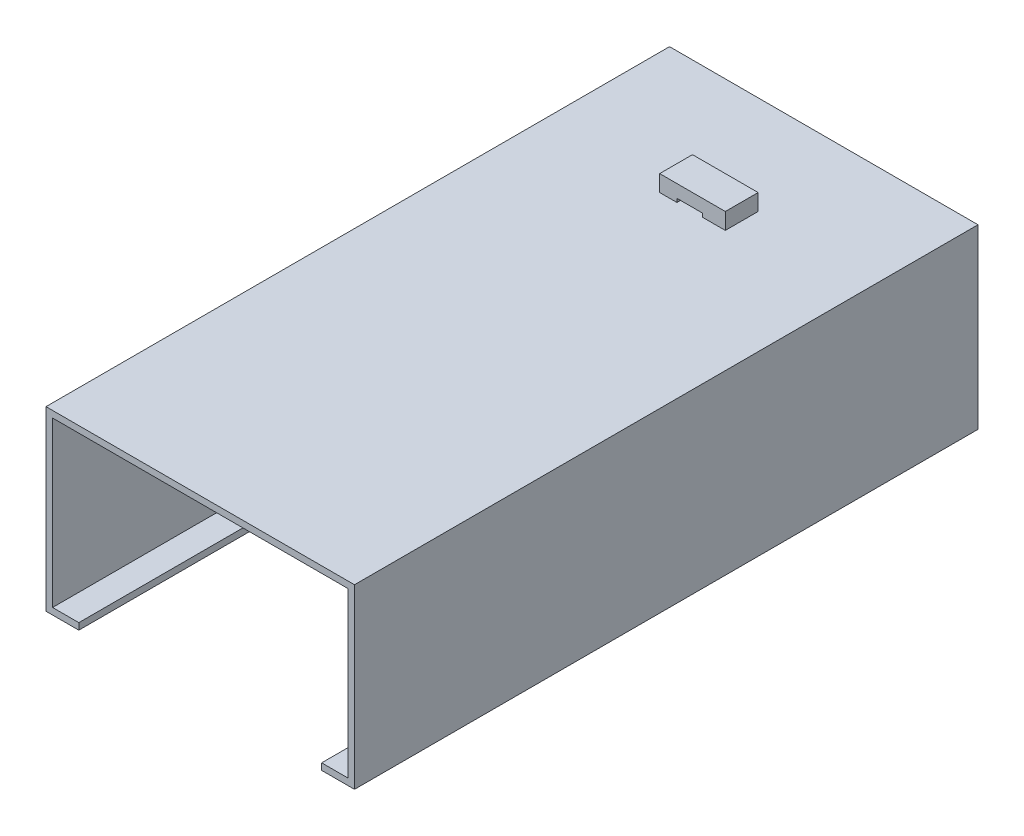
from build123d import *

# Parameters (mm, degrees)
BOSS_EXTRUDE1_DEPTH = 24.13
SKETCH2_W           = 2.54
SKETCH2_H           = 1.27
BOSS_EXTRUDE2_DEPTH = 0.635
CUT_EXTRUDE1_REACH  = 22.373
SKETCH3_W           = 0.984815379
SKETCH3_H           = 0.139763968


with BuildPart() as part:
    # Sketch1 → Boss-Extrude1 (new body)
    with BuildSketch(Plane.XY):
        Polygon((-5.715, 3.175), (-5.715, -3.175), (-4.699, -3.175), (-4.699, -3.429), (-5.969, -3.429), (-5.969, 3.429), (5.969, 3.429), (5.969, -3.429), (4.699, -3.429), (4.699, -3.175), (5.715, -3.175), (5.715, 3.175), align=None)
    extrude(amount=BOSS_EXTRUDE1_DEPTH)

    # Sketch2 → Boss-Extrude2 (add)
    with BuildSketch(Plane(origin=(0, 3.429, 0), x_dir=(1, 0, 0), z_dir=(0, 1, 0))):
        with Locations((0, -4.445)):
            Rectangle(SKETCH2_W, SKETCH2_H)
    extrude(amount=BOSS_EXTRUDE2_DEPTH)

    # Sketch3 → Cut-Extrude1 (cut, up to next)
    with BuildSketch(Plane.XY.offset(5.08), mode=Mode.PRIVATE) as cut_extrude1_sk1:
        with Locations((-0.110929993, 3.498881984)):
            Rectangle(SKETCH3_W, SKETCH3_H)
    cut_extrude1_tool1 = extrude(cut_extrude1_sk1.sketch, amount=-CUT_EXTRUDE1_REACH, mode=Mode.PRIVATE) & part.part
    add(cut_extrude1_tool1.solids().sort_by_distance((-0.11093, 3.498882, 5.08))[0], mode=Mode.SUBTRACT)


solid = part.part
